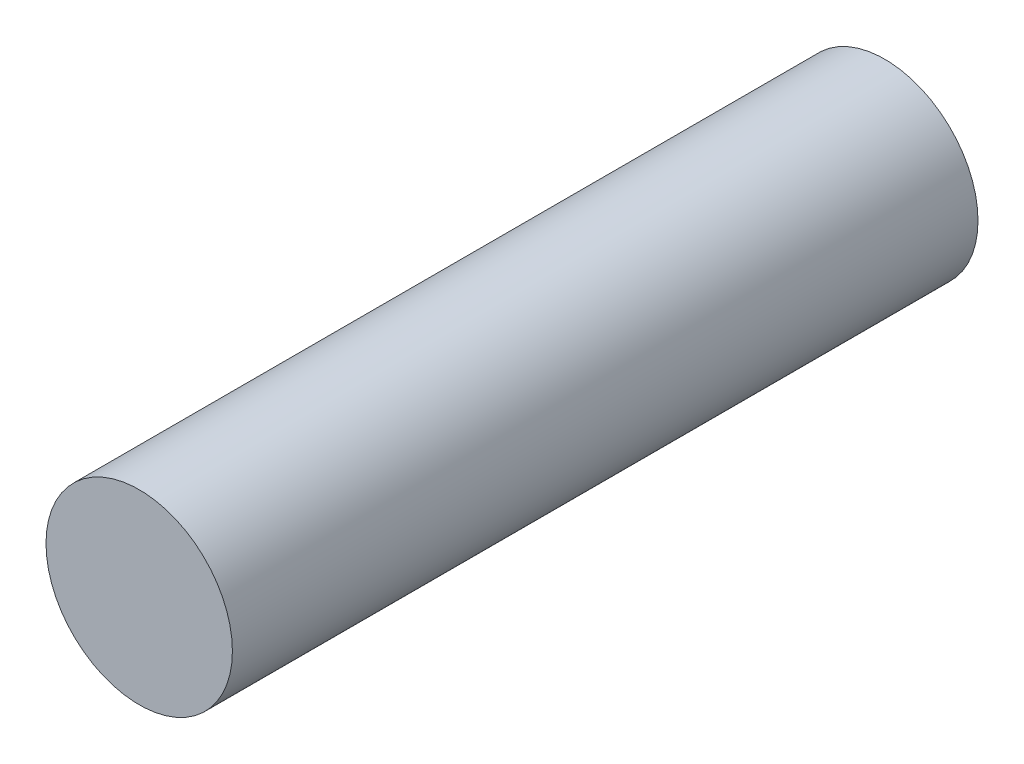
from build123d import *

# Parameters (mm, degrees)
SKETCH1_R           = 6.35
BOSS_EXTRUDE1_DEPTH = 50.8
SKETCH2_R           = 2.0193
CUT_EXTRUDE3_DEPTH  = 19.05


with BuildPart() as part:
    # Sketch1 → Boss-Extrude1 (new body)
    with BuildSketch(Plane.XY):
        with Locations((-5.146673194, 5.633520658)):
            Circle(SKETCH1_R)
    extrude(amount=BOSS_EXTRUDE1_DEPTH)

    # Sketch2 → Cut-Extrude3 (cut)
    with BuildSketch(Plane(origin=(0, 0, 0), x_dir=(-1, 0, 0), z_dir=(0, 0, -1))):
        with Locations((5.146673194, 5.633520658)):
            Circle(SKETCH2_R)
    extrude(amount=-CUT_EXTRUDE3_DEPTH, mode=Mode.SUBTRACT)


solid = part.part
